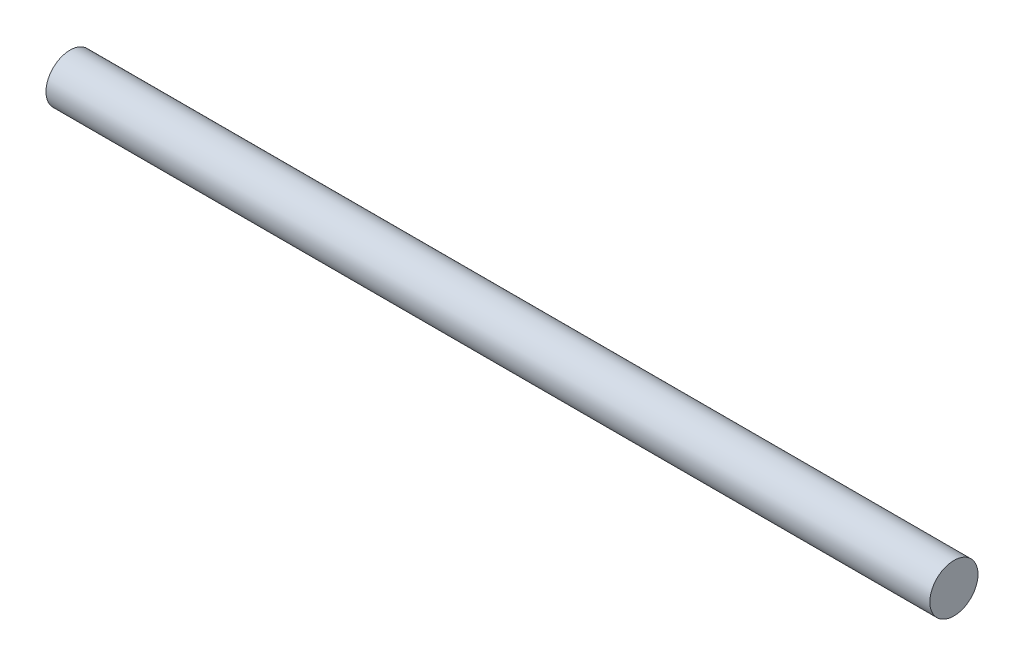
from build123d import *

# Parameters (mm, degrees)
BOSS_EXTRUDE1_DEPTH      = 163.2
BOSS_EXTRUDE1_DEPTH_BACK = 163.2
SKETCH1_R                = 8.89


with BuildPart() as part:
    # Sketch1 → Boss-Extrude1 (new, two sides: drawn at the far end of the back side and taken through both)
    with BuildSketch(Plane(origin=(0, 0, 0), x_dir=(0, 0, -1), z_dir=(1, 0, 0)).offset(-BOSS_EXTRUDE1_DEPTH_BACK)):
        Circle(SKETCH1_R)
    extrude(amount=BOSS_EXTRUDE1_DEPTH + BOSS_EXTRUDE1_DEPTH_BACK)


solid = part.part
